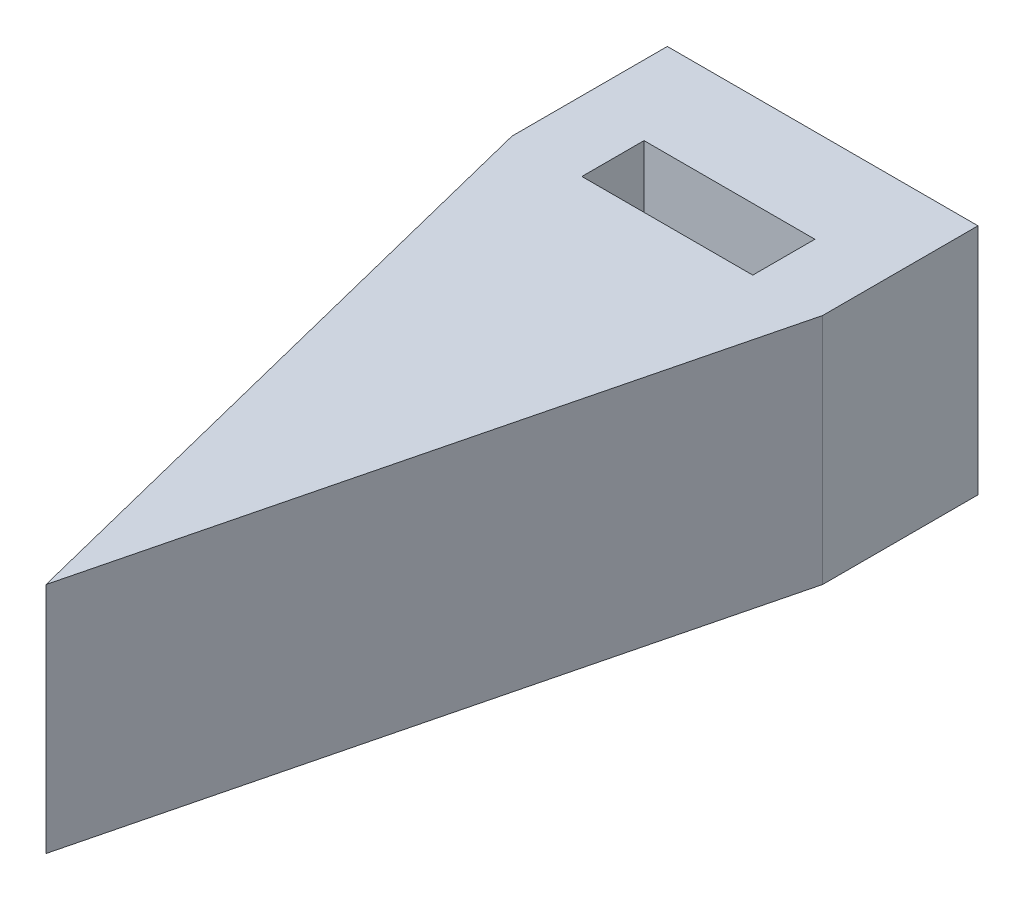
from build123d import *

# Parameters (mm, degrees)
SKETCH2_W  = 5.5
SKETCH2_H  = 2
BODY_DEPTH = 3.75


with BuildPart() as part:
    # Sketch2 → Body (new, symmetric)
    with BuildSketch(Plane(origin=(0, 0, 0), x_dir=(1, 0, 0), z_dir=(0, 1, 0))):
        Polygon((-5, -5), (0, -25), (5, -5), (5, 0), (-5, 0), align=None)
        with Locations((0, -4)):
            Rectangle(SKETCH2_W, SKETCH2_H, mode=Mode.SUBTRACT)
    extrude(amount=BODY_DEPTH, both=True)


solid = part.part
